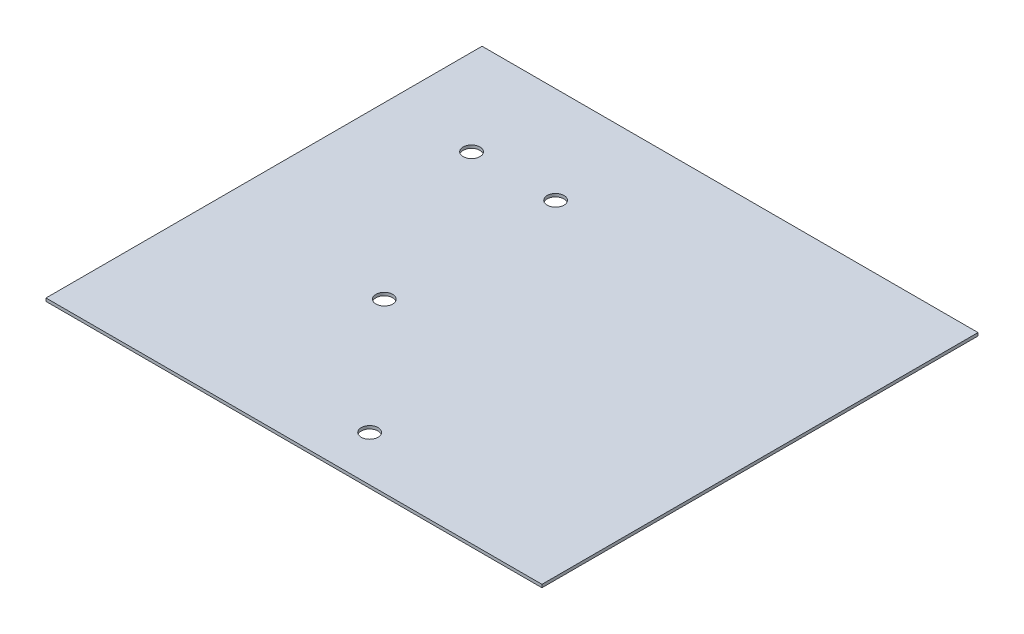
from build123d import *

# Parameters (mm, degrees)
SKETCH1_W           = 149.86
SKETCH1_H           = 131.7625
SKETCH1_R           = 2.54
BOSS_EXTRUDE1_DEPTH = 0.91186


with BuildPart() as part:
    # Sketch1 → Boss-Extrude1 (new body)
    with BuildSketch(Plane(origin=(0, 0, 0), x_dir=(1, 0, 0), z_dir=(0, 1, 0))):
        with Locations((74.93, 65.88125)):
            Rectangle(SKETCH1_W, SKETCH1_H)
        with Locations(Location((51.435, 50.8, 0), (0, 0, 90))):
            Circle(SKETCH1_R, mode=Mode.SUBTRACT)
        with Locations(Location((26.035, 102.5525, 0), (0, 0, 90))):
            Circle(SKETCH1_R, mode=Mode.SUBTRACT)
        with Locations(Location((51.435, 102.5525, 0), (0, 0, 90))):
            Circle(SKETCH1_R, mode=Mode.SUBTRACT)
        with Locations(Location((84.074, 13.716, 0), (0, 0, 90))):
            Circle(SKETCH1_R, mode=Mode.SUBTRACT)
    extrude(amount=BOSS_EXTRUDE1_DEPTH)


solid = part.part
